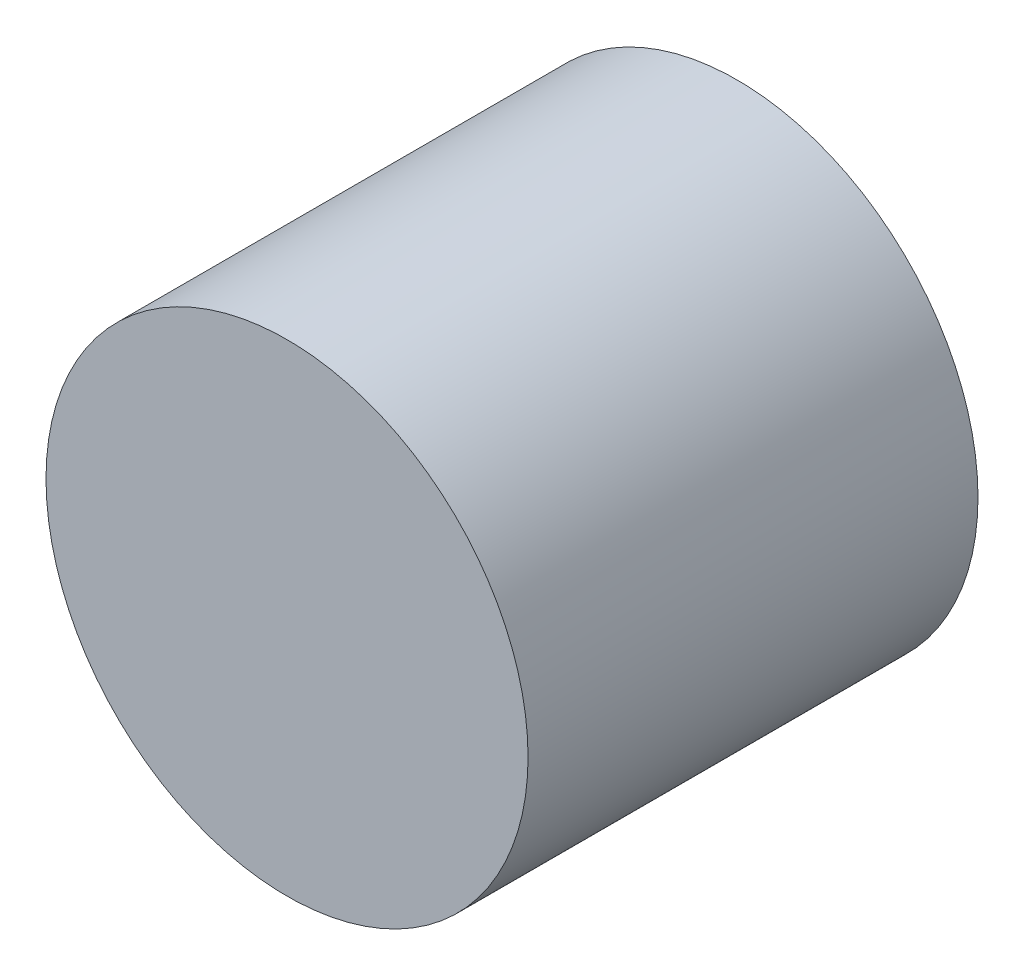
from build123d import *

# Parameters (mm, degrees)
SKETCH2_R           = 7.5
BOSS_EXTRUDE1_DEPTH = 14
SKETCH3_R           = 3
CUT_EXTRUDE1_DEPTH  = 13.8


with BuildPart() as part:
    # Sketch2 → Boss-Extrude1 (new body)
    with BuildSketch(Plane.XY):
        Circle(SKETCH2_R)
    extrude(amount=BOSS_EXTRUDE1_DEPTH)

    # Sketch3 → Cut-Extrude1 (cut)
    with BuildSketch(Plane(origin=(0, 0, 0), x_dir=(-1, 0, 0), z_dir=(0, 0, -1))):
        Circle(SKETCH3_R)
    extrude(amount=-CUT_EXTRUDE1_DEPTH, mode=Mode.SUBTRACT)


solid = part.part
